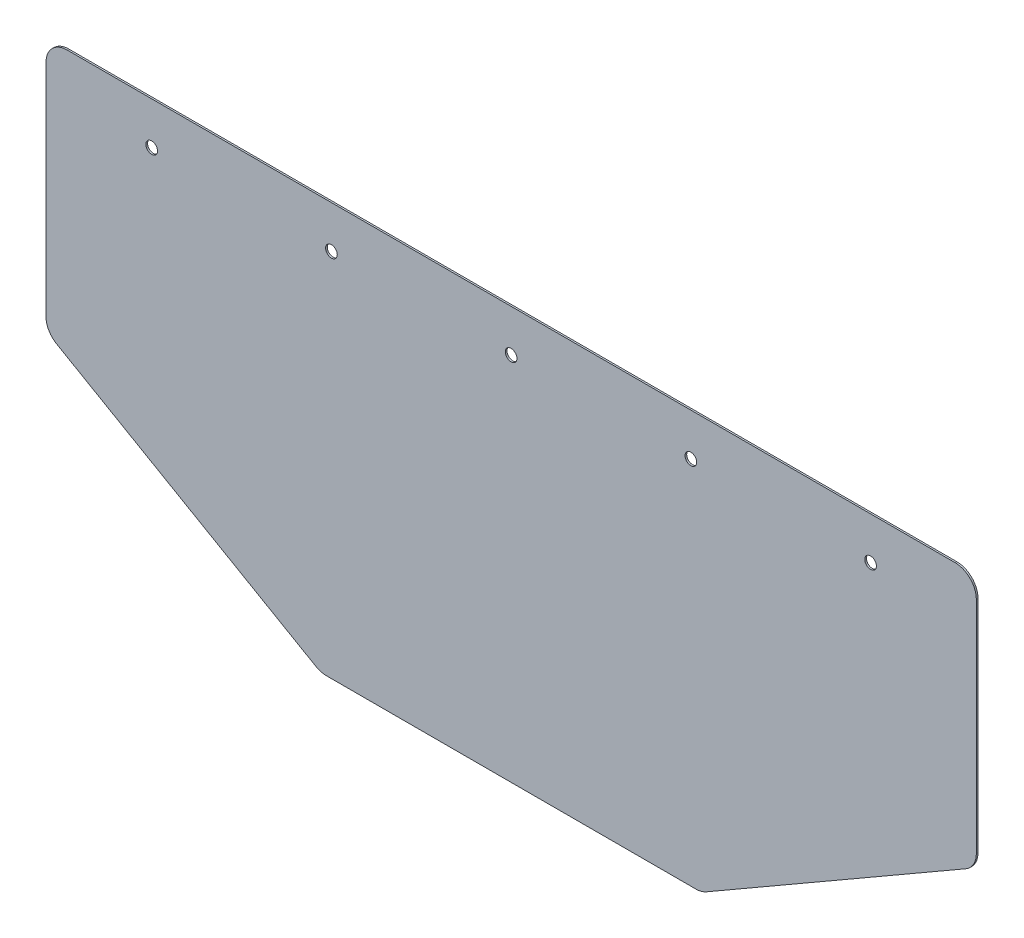
from build123d import *

# Parameters (mm, degrees)
SKETCH2_R           = 3.5
BOSS_EXTRUDE1_DEPTH = 1.016
FILLET1_R           = 12.7


with BuildPart() as part:
    # Sketch2 → Boss-Extrude1 (new body)
    with BuildSketch(Plane.XY):
        with BuildLine():
            Line((285.620600763, 115.53086565), (-273.179399237, 115.53086565))
            Line((-273.179399237, 115.53086565), (-273.179399237, -29.534072508))
            ThreePointArc((-273.179399237, -29.534072508), (-271.476904285, -35.885834684), (-266.825874397, -40.534629451))
            Line((-266.825874397, -40.534629451), (-111.025100537, -130.419691293))
            ThreePointArc((-111.025100537, -130.419691293), (-107.963661665, -131.686918852), (-104.678625377, -132.11913435))
            Line((-104.678625377, -132.11913435), (6.220600763, -132.11913435))
            Line((6.220600763, -132.11913435), (117.119826902, -132.11913435))
            ThreePointArc((117.119826902, -132.11913435), (120.40486319, -131.686918852), (123.466302062, -130.419691293))
            Line((123.466302062, -130.419691293), (279.267075922, -40.534629451))
            ThreePointArc((279.267075922, -40.534629451), (283.91810581, -35.885834684), (285.620600763, -29.534072508))
            Line((285.620600763, -29.534072508), (285.620600763, 115.53086565))
        make_face()
        with Locations((-209.679399237, 90.13086565)):
            Circle(SKETCH2_R, mode=Mode.SUBTRACT)
        with Locations((-101.729399237, 90.13086565)):
            Circle(SKETCH2_R, mode=Mode.SUBTRACT)
        with Locations((6.220600763, 90.13086565)):
            Circle(SKETCH2_R, mode=Mode.SUBTRACT)
        with Locations((114.170600763, 90.13086565)):
            Circle(SKETCH2_R, mode=Mode.SUBTRACT)
        with Locations((222.120600763, 90.13086565)):
            Circle(SKETCH2_R, mode=Mode.SUBTRACT)
    extrude(amount=BOSS_EXTRUDE1_DEPTH)

    # Fillet1
    fillet1_edges = [part.edges().sort_by_distance(p)[0] for p in [
        (-273.179399237, 115.53086565, 0.508),
        (285.620600763, 115.53086565, 0.508),
    ]]
    fillet(fillet1_edges, radius=FILLET1_R)


solid = part.part
